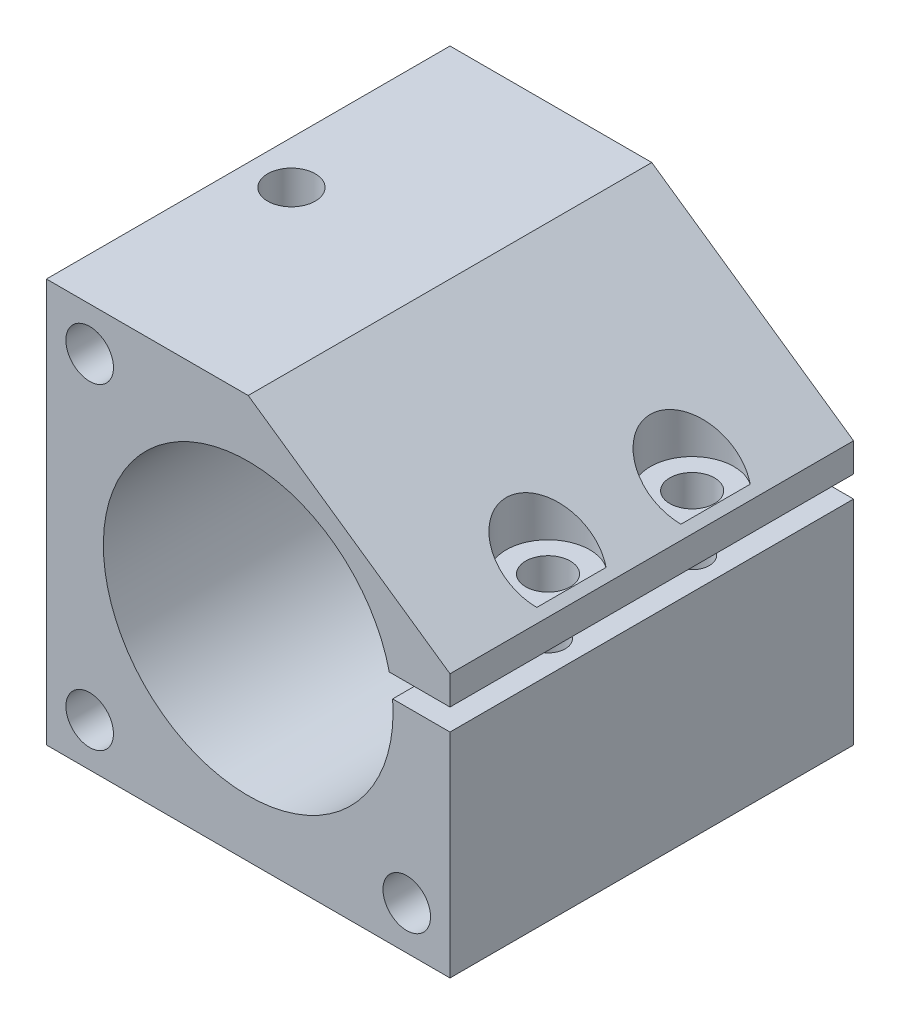
from build123d import *

# Parameters (mm, degrees)
ESQUISSE1_R                  = 1.65
BOSS_EXTRU_1_DEPTH           = 28
ENL_V_START                  = -2.4
ESQUISSE6_R                  = 2.9
ENL_V_MAT_EXTRU_3_DEPTH      = 33.885060109
ESQUISSE7_R                  = 1.55
ENL_V_MAT_EXTRU_4_DEPTH      = 3.9
ENL_V_MAT_EXTRU_5_DEPTH      = 35.618575031
ENL_V_MAT_EXTRU_5_DEPTH_BACK = 10
ESQUISSE8_R                  = 1.2
BOSS_EXTRU_6_START           = -17
ESQUISSE10_R                 = 1.65
BOSS_EXTRU_6_DEPTH           = 6
ESQUISSE11_R                 = 1.65
ENL_V_MAT_EXTRU_6_DEPTH      = 10
ENL_V_START_2                = -10
ESQUISSE12_R                 = 1.65
ENL_V_MAT_EXTRU_7_DEPTH      = 10


with BuildPart() as part:
    # Esquisse1 → Boss.-Extru.1 (new body)
    with BuildSketch(Plane.XY):
        with BuildLine():
            Line((0, 14), (14, 4.279909917))
            Line((14, 4.279909917), (14, 2.279909917))
            Line((14, 2.279909917), (9.787977869, 2.279909917))
            ThreePointArc((9.787977869, 2.279909917), (-9.932192744, -1.534290483), (10.019692636, 0.779909917))
            Line((10.019692636, 0.779909917), (14, 0.779909917))
            Line((14, 0.779909917), (14, -14))
            Line((14, -14), (-14, -14))
            Line((-14, -14), (-14, 14))
            Line((-14, 14), (0, 14))
        make_face()
        with Locations((-11, 11)):
            Circle(ESQUISSE1_R, mode=Mode.SUBTRACT)
        with Locations(Location((-11, -11, 0), (0, 0, 180))):
            Circle(ESQUISSE1_R, mode=Mode.SUBTRACT)
        with Locations((11, -11)):
            Circle(ESQUISSE1_R, mode=Mode.SUBTRACT)
    extrude(amount=BOSS_EXTRU_1_DEPTH)

    # Esquisse6 → Enlèv. mat.-Extru.3 (cut, through all)
    with BuildSketch(Plane(origin=(0, 2.279909917, 0), x_dir=(-1, 0, 0), z_dir=(0, -1, 0)).offset(ENL_V_START)):
        with Locations((-11.8, -9)):
            Circle(ESQUISSE6_R)
        with Locations((-11.8, -19)):
            Circle(ESQUISSE6_R)
    extrude(amount=-ENL_V_MAT_EXTRU_3_DEPTH, mode=Mode.SUBTRACT)

    # Esquisse7 → Enlèv. mat.-Extru.4 (cut)
    with BuildSketch(Plane(origin=(0, 4.679909917, 0), x_dir=(1, 0, 0), z_dir=(0, 1, 0))):
        with Locations(Location((11.8, -9, 0), (0, 0, 270))):
            Circle(ESQUISSE7_R)
        with Locations(Location((11.8, -19, 0), (0, 0, 270))):
            Circle(ESQUISSE7_R)
    extrude(amount=-ENL_V_MAT_EXTRU_4_DEPTH, mode=Mode.SUBTRACT)

    # Esquisse8 → Enlèv. mat.-Extru.5 (cut, two sides: drawn at the far end of the back side and taken through both)
    with BuildSketch(Plane(origin=(0, 0.779909917, 0), x_dir=(1, 0, 0), z_dir=(0, 1, 0)).offset(-ENL_V_MAT_EXTRU_5_DEPTH_BACK)):
        with Locations((11.8, -9)):
            Circle(ESQUISSE8_R)
        with Locations((11.8, -19)):
            Circle(ESQUISSE8_R)
    extrude(amount=ENL_V_MAT_EXTRU_5_DEPTH + ENL_V_MAT_EXTRU_5_DEPTH_BACK, mode=Mode.SUBTRACT)

    # Esquisse10 → Boss.-Extru.6 (add)
    with BuildSketch(Plane.XY.offset(28).offset(BOSS_EXTRU_6_START)):
        with Locations(Location((-11, -11, 0), (0, 0, 180))):
            Circle(ESQUISSE10_R)
        with Locations((11, -11)):
            Circle(ESQUISSE10_R)
        with Locations((-11, 11)):
            Circle(ESQUISSE10_R)
    extrude(amount=BOSS_EXTRU_6_DEPTH)

    # Esquisse11 → Enlèv. mat.-Extru.6 (cut)
    with BuildSketch(Plane(origin=(0, -14, 0), x_dir=(1, 0, 0), z_dir=(0, 1, 0))):
        with Locations(Location((-11, -14, 0), (0, 0, 270))):
            Circle(ESQUISSE11_R)
        with Locations(Location((11, -14, 0), (0, 0, 90))):
            Circle(ESQUISSE11_R)
    extrude(amount=ENL_V_MAT_EXTRU_6_DEPTH, mode=Mode.SUBTRACT)

    # Esquisse12 → Enlèv. mat.-Extru.7 (cut)
    with BuildSketch(Plane(origin=(0, 14, 0), x_dir=(1, 0, 0), z_dir=(0, 1, 0)).offset(ENL_V_START_2)):
        with Locations(Location((-11, -14, 0), (0, 0, 270))):
            Circle(ESQUISSE12_R)
    extrude(amount=ENL_V_MAT_EXTRU_7_DEPTH, mode=Mode.SUBTRACT)


solid = part.part
